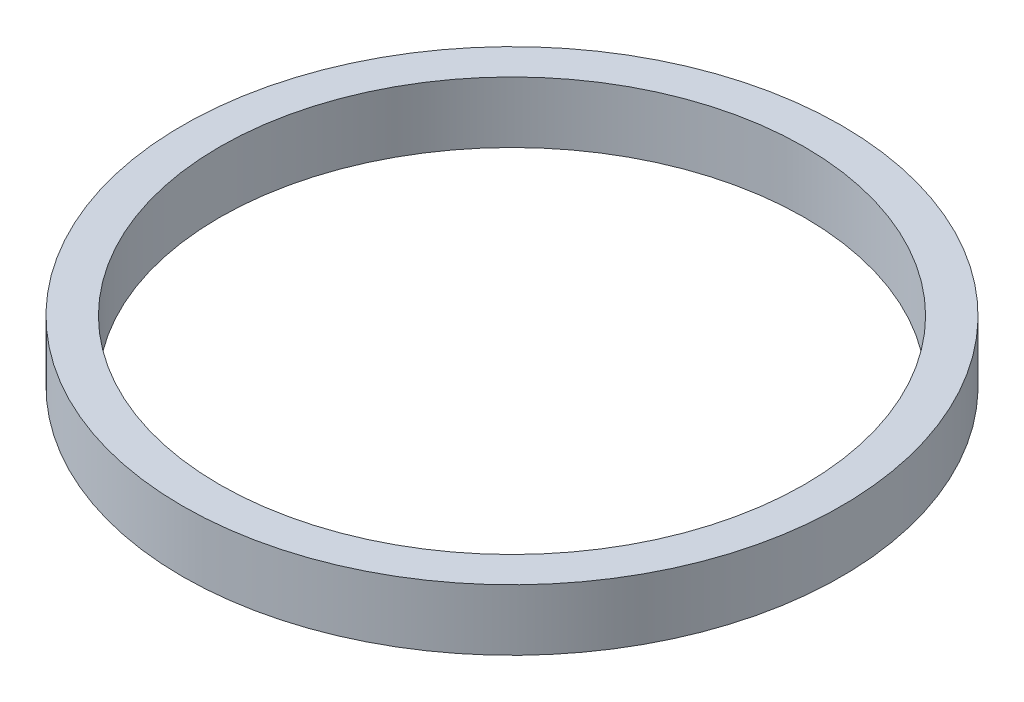
from build123d import *

# Parameters (mm, degrees)
ESBO_O1_R                = 37.75
ESBO_O1_R_2              = 33.5
RESSALTO_EXTRUS_O1_DEPTH = 7


with BuildPart() as part:
    # Esboço1 → Ressalto-extrusão1 (new body)
    with BuildSketch(Plane(origin=(0, 0, 0), x_dir=(1, 0, 0), z_dir=(0, 1, 0))):
        with Locations(Location((0, 0, 0), (0, 0, 270))):
            Circle(ESBO_O1_R)
        with Locations(Location((0, 0, 0), (0, 0, 270))):
            Circle(ESBO_O1_R_2, mode=Mode.SUBTRACT)
    extrude(amount=RESSALTO_EXTRUS_O1_DEPTH)


solid = part.part
